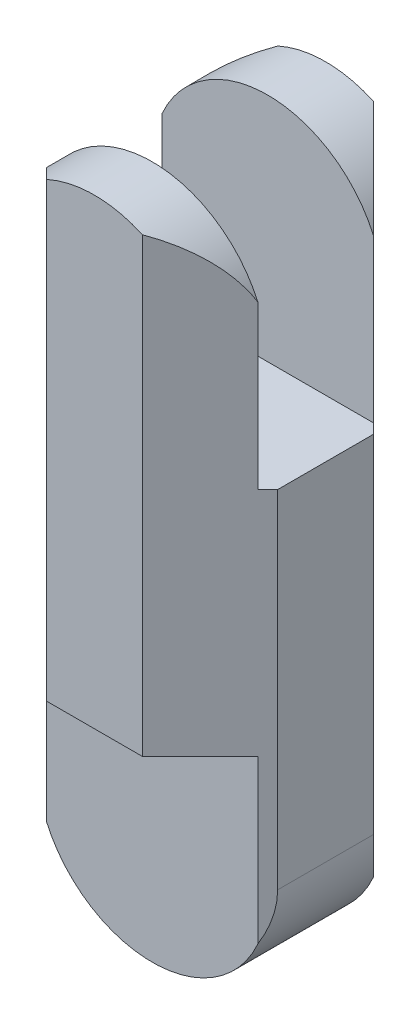
from build123d import *

# Parameters (mm, degrees)
EXTRUDE_1_DEPTH     = 60
CUT_EXTRUDE_1_DEPTH = 66
CUT_EXTRUDE_2_DEPTH = 5
CUT_EXTRUDE_START   = -5
CUT_EXTRUDE_3_DEPTH = 5
SKETCH_6_W          = 20
SKETCH_6_H          = 20
CUT_EXTRUDE_4_DEPTH = 5
CUT_EXTRUDE_5_DEPTH = 30


with BuildPart() as part:
    # 草图1 → 凸台-拉伸1 (new body)
    with BuildSketch(Plane(origin=(0, 0, 0), x_dir=(1, 0, 0), z_dir=(0, 1, 0))):
        Polygon((10, 4.142135624), (4.142135624, 10), (-4.142135624, 10), (-10, 4.142135624), (-10, -4.142135624), (-4.142135624, -10), (4.142135624, -10), (10, -4.142135624), align=None)
    extrude(amount=EXTRUDE_1_DEPTH)

    # 草图2 → 切除-拉伸1 (cut)
    with BuildSketch(Plane.XY.offset(10)):
        with BuildLine():
            Line((-10, 10), (-10, -2.389295552))
            Line((-10, -2.389295552), (10, -2.389295552))
            Line((10, -2.389295552), (10, 10))
            ThreePointArc((10, 10), (0, 0), (-10, 10))
        make_face()
    extrude(amount=-CUT_EXTRUDE_1_DEPTH, mode=Mode.SUBTRACT)

    # 草图4 → 切除-拉伸2 (cut)
    with BuildSketch(Plane.XY.offset(10)):
        with BuildLine():
            Line((-10, 10), (-10, 20))
            Line((-10, 20), (10, 20))
            Line((10, 20), (10, 10))
            ThreePointArc((10, 10), (0, 0), (-10, 10))
        make_face()
    extrude(amount=-CUT_EXTRUDE_2_DEPTH, mode=Mode.SUBTRACT)

    # 草图5 → 切除-拉伸3 (cut)
    with BuildSketch(Plane(origin=(0, 0, -10), x_dir=(-1, 0, 0), z_dir=(0, 0, -1)).offset(CUT_EXTRUDE_START)):
        with BuildLine():
            Line((-10, 10), (-10, 20))
            Line((-10, 20), (10, 20))
            Line((10, 20), (10, 10))
            ThreePointArc((10, 10), (0, 0), (-10, 10))
        make_face()
    extrude(amount=CUT_EXTRUDE_3_DEPTH, mode=Mode.SUBTRACT)

    # 草图6 → 切除-拉伸4 (cut, symmetric)
    with BuildSketch(Plane.XY):
        with Locations((0, 50)):
            Rectangle(SKETCH_6_W, SKETCH_6_H)
    extrude(amount=CUT_EXTRUDE_4_DEPTH, both=True, mode=Mode.SUBTRACT)

    # 草图7 → 切除-拉伸5 (cut)
    with BuildSketch(Plane.XY.offset(10)):
        with BuildLine():
            Line((-10, 50), (-10, 63.661192365))
            Line((-10, 63.661192365), (10, 63.661192365))
            Line((10, 63.661192365), (10, 50))
            ThreePointArc((10, 50), (0, 60), (-10, 50))
        make_face()
    extrude(amount=-CUT_EXTRUDE_5_DEPTH, mode=Mode.SUBTRACT)


solid = part.part
